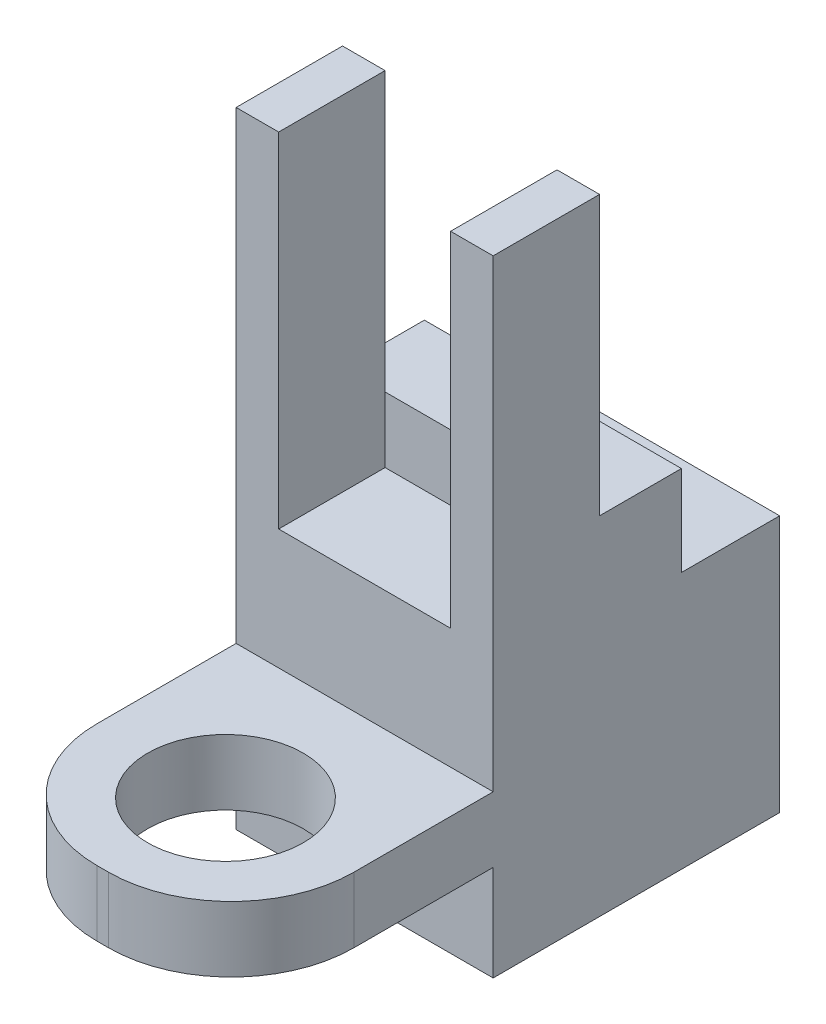
from build123d import *

# Parameters (mm, degrees)
SKETCH4_W            = 31.4
SKETCH4_H            = 31.4
SKETCH4_W_2          = 25.4
SKETCH4_H_2          = 25.4
BOSS_EXTRUDE3_DEPTH  = 30
SKETCH5_W            = 31.4
SKETCH5_H            = 31.4
BOSS_EXTRUDE4_DEPTH  = 5
SKETCH6_W            = 31.4
SKETCH6_H            = 8
BOSS_EXTRUDE5_DEPTH  = 5
BOSS_EXTRUDE6_DEPTH  = 8
SKETCH8_R            = 9.5
BOSS_EXTRUDE7_DEPTH  = 8
SKETCH9_W            = 31.4
SKETCH9_H            = 10
BOSS_EXTRUDE8_DEPTH  = 5
SKETCH10_W           = 31.4
SKETCH10_H           = 10
BOSS_EXTRUDE9_DEPTH  = 11
SKETCH11_W           = 5.2
SKETCH11_H           = 10
BOSS_EXTRUDE10_DEPTH = 40
BOSS_EXTRUDE11_DEPTH = 3
CUT_EXTRUDE1_START   = 8
SKETCH8_2_R          = 9.5
CUT_EXTRUDE1_DEPTH   = 24
SKETCH14_W           = 21
SKETCH14_H           = 13
CUT_EXTRUDE2_DEPTH   = 2


with BuildPart() as part:
    # Sketch4 → Boss-Extrude3 (new body)
    with BuildSketch(Plane.XY):
        Rectangle(SKETCH4_W, SKETCH4_H)
        Rectangle(SKETCH4_W_2, SKETCH4_H_2, mode=Mode.SUBTRACT)
    extrude(amount=BOSS_EXTRUDE3_DEPTH)

    # Sketch5 → Boss-Extrude4 (add)
    with BuildSketch(Plane.XY.offset(30)):
        Rectangle(SKETCH5_W, SKETCH5_H)
    extrude(amount=BOSS_EXTRUDE4_DEPTH)

    # Sketch6 → Boss-Extrude5 (add)
    with BuildSketch(Plane.XY.offset(35)):
        Rectangle(SKETCH6_W, SKETCH6_H)
    extrude(amount=BOSS_EXTRUDE5_DEPTH)

    # Sketch7 → Boss-Extrude6 (add)
    with BuildSketch(Plane.XZ.offset(4)):
        with BuildLine():
            Line((-15.7, 40), (-15.7, 52))
            ThreePointArc((-15.7, 52), (-11.306601718, 62.606601718), (-0.7, 67))
            Line((-0.7, 67), (0.7, 67))
            ThreePointArc((0.7, 67), (11.306601718, 62.606601718), (15.7, 52))
            Line((15.7, 52), (15.7, 40))
            Line((15.7, 40), (-15.7, 40))
        make_face()
    extrude(amount=-BOSS_EXTRUDE6_DEPTH)

    # Sketch8 → Boss-Extrude7 (add)
    with BuildSketch(Plane.XZ.offset(4)):
        with Locations((0, 52)):
            Circle(SKETCH8_R)
    boss_extrude7 = extrude(amount=BOSS_EXTRUDE7_DEPTH)

    # Mirror1: Boss-Extrude7 across plane
    add(boss_extrude7.mirror(Plane.ZX))

    # Sketch9 → Boss-Extrude8 (add)
    with BuildSketch(Plane(origin=(0, 15.7, 0), x_dir=(1, 0, 0), z_dir=(0, 1, 0))):
        with Locations((0, -27)):
            Rectangle(SKETCH9_W, SKETCH9_H)
    extrude(amount=BOSS_EXTRUDE8_DEPTH)

    # Sketch10 → Boss-Extrude9 (add)
    with BuildSketch(Plane(origin=(0, 15.7, 0), x_dir=(1, 0, 0), z_dir=(0, 1, 0))):
        with Locations((0, -17)):
            Rectangle(SKETCH10_W, SKETCH10_H)
    extrude(amount=BOSS_EXTRUDE9_DEPTH)

    # Sketch11 → Boss-Extrude10 (add)
    with BuildSketch(Plane(origin=(0, 20.7, 0), x_dir=(1, 0, 0), z_dir=(0, 1, 0))):
        with Locations((-13.1, -27)):
            Rectangle(SKETCH11_W, SKETCH11_H)
        with Locations((13.1, -27)):
            Rectangle(SKETCH11_W, SKETCH11_H)
    extrude(amount=BOSS_EXTRUDE10_DEPTH)

    # Sketch12 → Boss-Extrude11 (add)
    with BuildSketch(Plane.XY.offset(32)):
        Polygon((-15.7, 60.7), (-10.5, 60.7), (-10.5, 20.7), (10.5, 20.7), (10.5, 60.7), (15.7, 60.7), (15.7, 15.7), (-15.7, 15.7), align=None)
    extrude(amount=BOSS_EXTRUDE11_DEPTH)

    # Sketch8<2> → Cut-Extrude1 (cut)
    with BuildSketch(Plane.XZ.offset(4).offset(CUT_EXTRUDE1_START)):
        with Locations((0, 52)):
            Circle(SKETCH8_2_R)
    extrude(amount=-CUT_EXTRUDE1_DEPTH, mode=Mode.SUBTRACT)

    # Sketch14 → Cut-Extrude2 (cut)
    with BuildSketch(Plane(origin=(0, 20.7, 0), x_dir=(1, 0, 0), z_dir=(0, 1, 0))):
        with Locations((0, -28.5)):
            Rectangle(SKETCH14_W, SKETCH14_H)
    extrude(amount=-CUT_EXTRUDE2_DEPTH, mode=Mode.SUBTRACT)


solid = part.part
